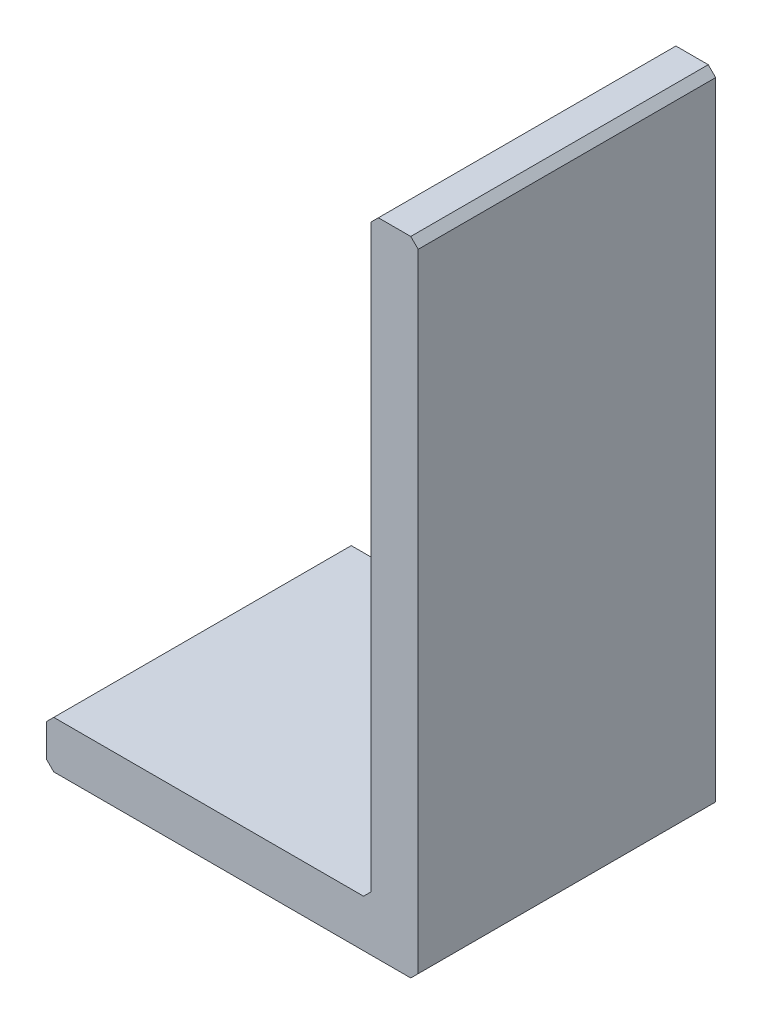
from build123d import *

# Parameters (mm, degrees)
SKETCH1_W           = 25
SKETCH1_H           = 20
BOSS_EXTRUDE1_DEPTH = 3.175
SKETCH3_W           = 3.175
SKETCH3_H           = 20
BOSS_EXTRUDE2_DEPTH = 40
CHAMFER1_SIZE       = 0.5


with BuildPart() as part:
    # Sketch1 → Boss-Extrude1 (new body)
    with BuildSketch(Plane(origin=(0, 0, 0), x_dir=(1, 0, 0), z_dir=(0, 1, 0))):
        Rectangle(SKETCH1_W, SKETCH1_H)
    extrude(amount=BOSS_EXTRUDE1_DEPTH)

    # Sketch3 → Boss-Extrude2 (add)
    with BuildSketch(Plane(origin=(0, 3.175, 0), x_dir=(1, 0, 0), z_dir=(0, 1, 0))):
        with Locations((10.9125, 0)):
            Rectangle(SKETCH3_W, SKETCH3_H)
    extrude(amount=BOSS_EXTRUDE2_DEPTH)

    # Chamfer1
    chamfer1_edges = [part.edges().sort_by_distance(p)[0] for p in [
        (-12.5, 3.175, 0),
        (9.325, 3.175, 0),
        (12.5, 43.175, 0),
        (9.325, 43.175, 0),
        (-12.5, 0, 0),
        (12.5, 0, 0),
    ]]
    chamfer(chamfer1_edges, length=CHAMFER1_SIZE)


solid = part.part
